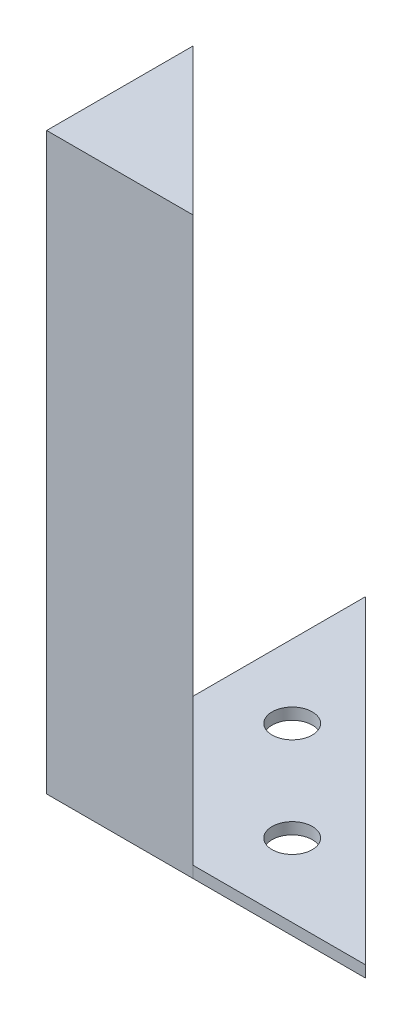
from build123d import *

# Parameters (mm, degrees)
EXTRUDE_1_DEPTH     = 50
EXTRUDE_2_DEPTH     = 1
SKETCH_3_R          = 1.75
CUT_EXTRUDE_1_DEPTH = 1
SHELL_1_T           = -2
CUT_EXTRUDE_2_DEPTH = 2


with BuildPart() as part:
    # 草图1 → 凸台-拉伸1 (new body)
    with BuildSketch(Plane(origin=(0, 0, 0), x_dir=(1, 0, 0), z_dir=(0, 1, 0))):
        Polygon((0, 0), (12.727922061, 0), (0, 12.727922061), align=None)
    extrude(amount=EXTRUDE_1_DEPTH)

    # 抽壳1
    shell_1_openings = [part.faces().sort_by_distance(p)[0] for p in [
        (4.242640687, 0, -4.242640687),
    ]]
    offset(amount=SHELL_1_T, openings=shell_1_openings, kind=Kind.INTERSECTION)

    # 草图4 → 切除-拉伸2 (cut)
    with BuildSketch(Plane(origin=(6.363961031, 0, -6.363961031), x_dir=(-0.7071067811865475, 0, -0.7071067811865477), z_dir=(0.7071067811865477, 0, -0.7071067811865475))):
        with BuildLine():
            Line((-2.996811013, 42.5), (3, 42.5))
            ThreePointArc((3, 42.5), (3.5, 42), (3, 41.5))
            Line((3, 41.5), (-2.996811013, 41.5))
            ThreePointArc((-2.996811013, 41.5), (-3.496811013, 42), (-2.996811013, 42.5))
        make_face()
    extrude(amount=-CUT_EXTRUDE_2_DEPTH, mode=Mode.SUBTRACT)


with BuildPart() as body_2:
    # 草图2 → 凸台-拉伸2 (new body)
    with BuildSketch(Plane(origin=(0, 0, 0), x_dir=(-1, 0, 0), z_dir=(0, -1, 0))):
        Polygon((0, 12.727922061), (0, 27.727922061), (-27.727922061, 0), (-12.727922061, 0), align=None)
    extrude(amount=-EXTRUDE_2_DEPTH)

    # 草图3 → 切除-拉伸1 (cut)
    with BuildSketch(Plane(origin=(0, 0, 0), x_dir=(-1, 0, 0), z_dir=(0, -1, 0))):
        with Locations(Location((-15, 6.363961031, 0), (0, 0, 90))):
            Circle(SKETCH_3_R)
        with Locations(Location((-6.363961031, 15, 0), (0, 0, 90))):
            Circle(SKETCH_3_R)
    extrude(amount=-CUT_EXTRUDE_1_DEPTH, mode=Mode.SUBTRACT)


solid = Compound([part.part, body_2.part])
